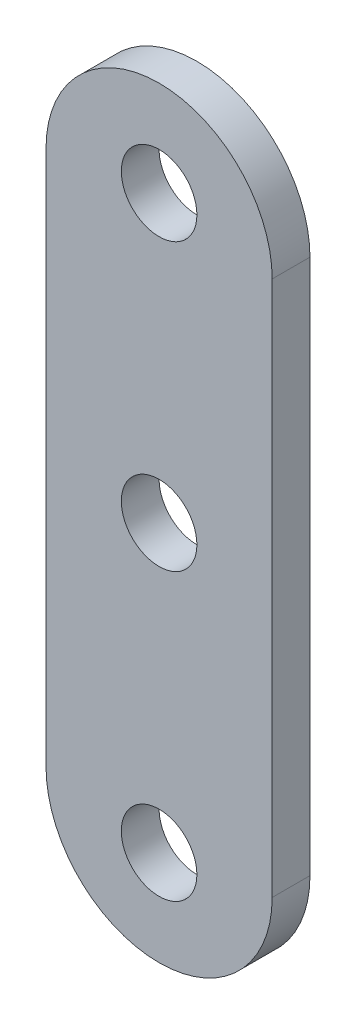
from build123d import *

# Parameters (mm, degrees)
BOSS_EXTRUDE1_DEPTH = 3.175
SKETCH2_R           = 3.175
CUT_EXTRUDE1_DEPTH  = 34.531039724
LPATTERN1_COUNT     = 2
LPATTERN1_PITCH     = 24
LPATTERN1_COL_COUNT = 2
LPATTERN1_COL_PITCH = 24


with BuildPart() as part:
    # Sketch1 → Boss-Extrude1 (new body)
    with BuildSketch(Plane.XY):
        with BuildLine():
            Line((-9.5, -22.5), (-9.5, 22.5))
            ThreePointArc((-9.5, 22.5), (0, 32), (9.5, 22.5))
            Line((9.5, 22.5), (9.5, -22.5))
            ThreePointArc((9.5, -22.5), (0, -32), (-9.5, -22.5))
        make_face()
    extrude(amount=BOSS_EXTRUDE1_DEPTH)

    # Sketch2 → Cut-Extrude1 (cut, through all)
    with BuildSketch(Plane.XY.offset(3.175)):
        Circle(SKETCH2_R)
    cut_extrude1 = extrude(amount=-CUT_EXTRUDE1_DEPTH, mode=Mode.SUBTRACT)

    # LPattern1: Cut-Extrude1 ×2
    with Locations(*[(0, i * LPATTERN1_PITCH, 0) for i in range(1, LPATTERN1_COUNT)]):
        add(cut_extrude1, mode=Mode.SUBTRACT)

    # LPattern1 col: Cut-Extrude1 ×2
    with Locations(*[(0, -i * LPATTERN1_COL_PITCH, 0) for i in range(1, LPATTERN1_COL_COUNT)]):
        add(cut_extrude1, mode=Mode.SUBTRACT)


solid = part.part
